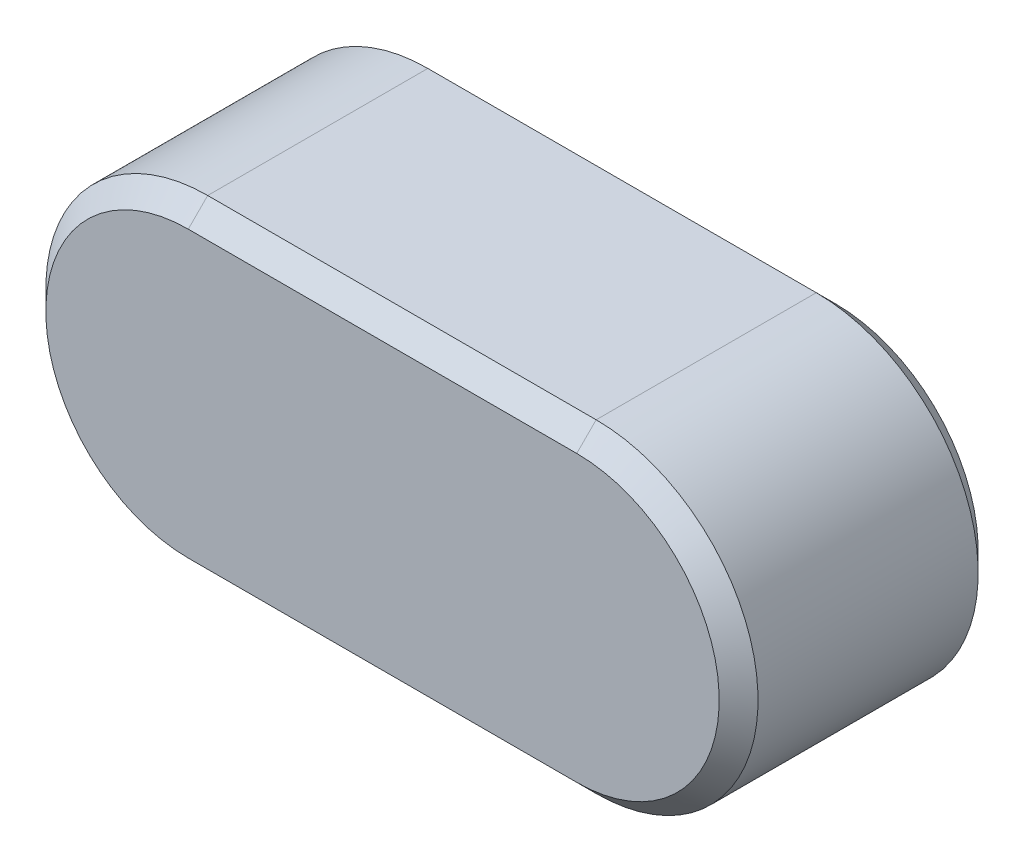
from build123d import *

# Parameters (mm, degrees)
BASEKEY_DEPTH = 4
CHAMFER1_SIZE = 0.6


with BuildPart() as part:
    # Sketch1 → BaseKey (new, symmetric)
    with BuildSketch(Plane.XY):
        with BuildLine():
            Line((-12, 5), (0, 5))
            ThreePointArc((0, 5), (5, 0), (0, -5))
            Line((0, -5), (-12, -5))
            ThreePointArc((-12, -5), (-17, 0), (-12, 5))
        make_face()
    extrude(amount=BASEKEY_DEPTH, both=True)

    # Chamfer1
    chamfer1_edges = [part.edges().sort_by_distance(p)[0] for p in [
        (5, 0, 4),
        (-6, 5, 4),
        (-17, 0, 4),
        (-6, 5, -4),
        (5, 0, -4),
        (-6, -5, -4),
        (-17, 0, -4),
        (-6, -5, 4),
    ]]
    chamfer(chamfer1_edges, length=CHAMFER1_SIZE)


solid = part.part
